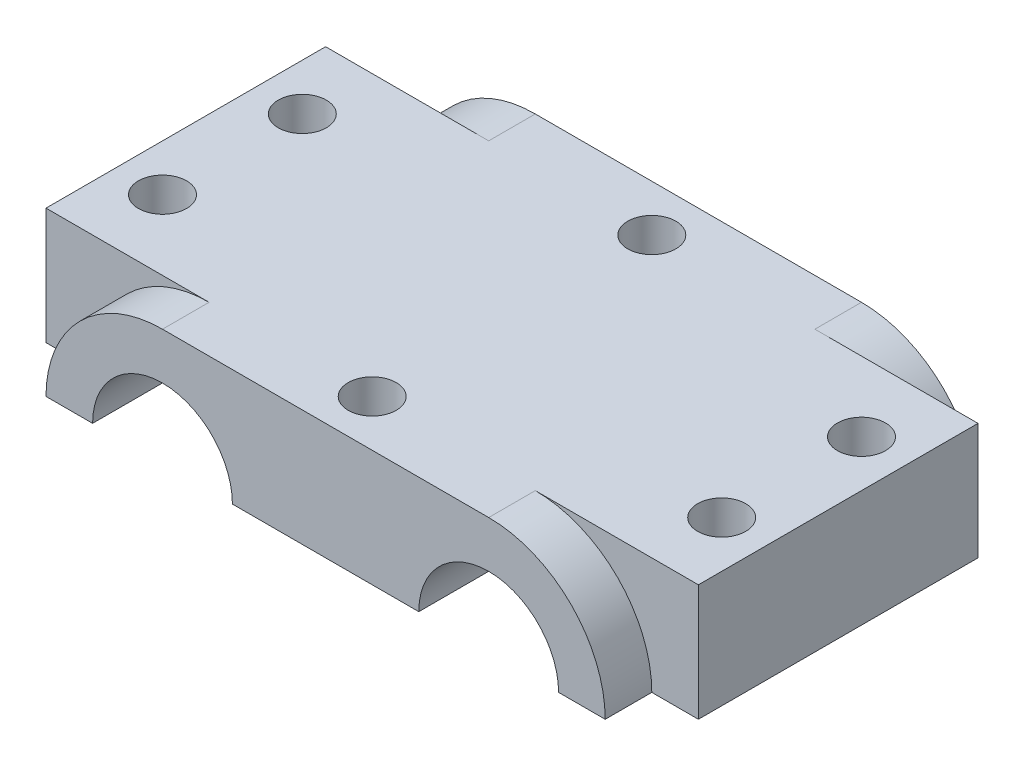
from build123d import *

# Parameters (mm, degrees)
BOSS_EXTRUDE9_DEPTH   = 38.1
BOSS_EXTRUDE9_2_DEPTH = 38.1
BOSS_EXTRUDE10_DEPTH  = 50.8
SKETCH3_R             = 6.5532
CUT_EXTRUDE3_DEPTH    = 101.6


with BuildPart() as part:
    # Sketch1 → Boss-Extrude9 (new, symmetric)
    with BuildSketch(Plane.XY):
        with BuildLine():
            Line((76.2, -15.875), (88.9, -15.875))
            Line((88.9, -15.875), (88.9, 15.875))
            Line((88.9, 15.875), (44.45, 15.875))
            ThreePointArc((44.45, 15.875), (66.900640303, 6.575640303), (76.2, -15.875))
        make_face()
    extrude(amount=BOSS_EXTRUDE9_DEPTH, both=True)



with BuildPart() as body_2:
    # Sketch1 → Boss-Extrude9 2 (new, symmetric)
    with BuildSketch(Plane.XY):
        with BuildLine():
            ThreePointArc((-76.2, -15.875), (-66.900640303, 6.575640303), (-44.45, 15.875))
            Line((-44.45, 15.875), (-88.9, 15.875))
            Line((-88.9, 15.875), (-88.9, -15.875))
            Line((-88.9, -15.875), (-76.2, -15.875))
        make_face()
    extrude(amount=BOSS_EXTRUDE9_2_DEPTH, both=True)


with BuildPart() as part_1:
    add(part.part)

    add(body_2.part)  # Boss-Extrude10 merges body 2
    # Sketch1<11> → Boss-Extrude10 (add, symmetric)
    with BuildSketch(Plane.XY):
        with BuildLine():
            Line((63.5, -15.875), (76.2, -15.875))
            ThreePointArc((76.2, -15.875), (66.900640303, 6.575640303), (44.45, 15.875))
            Line((44.45, 15.875), (-44.45, 15.875))
            ThreePointArc((-44.45, 15.875), (-66.900640303, 6.575640303), (-76.2, -15.875))
            Line((-76.2, -15.875), (-63.5, -15.875))
            ThreePointArc((-63.5, -15.875), (-44.45, 3.175), (-25.4, -15.875))
            Line((-25.4, -15.875), (2.119780236, -15.875))
            Line((2.119780236, -15.875), (25.4, -15.875))
            ThreePointArc((25.4, -15.875), (44.45, 3.175), (63.5, -15.875))
        make_face()
    extrude(amount=BOSS_EXTRUDE10_DEPTH, both=True)

    # Sketch3 → Cut-Extrude3 (cut)
    with BuildSketch(Plane(origin=(0, 15.875, 0), x_dir=(1, 0, 0), z_dir=(0, 1, 0))):
        with Locations((-76.2, 19.05)):
            Circle(SKETCH3_R)
        with Locations((0, 38.1)):
            Circle(SKETCH3_R)
        with Locations((76.2, 19.05)):
            Circle(SKETCH3_R)
        with Locations((76.2, -19.05)):
            Circle(SKETCH3_R)
        with Locations((0, -38.1)):
            Circle(SKETCH3_R)
        with Locations((-76.2, -19.05)):
            Circle(SKETCH3_R)
    extrude(amount=-CUT_EXTRUDE3_DEPTH, mode=Mode.SUBTRACT)


solid = part_1.part
